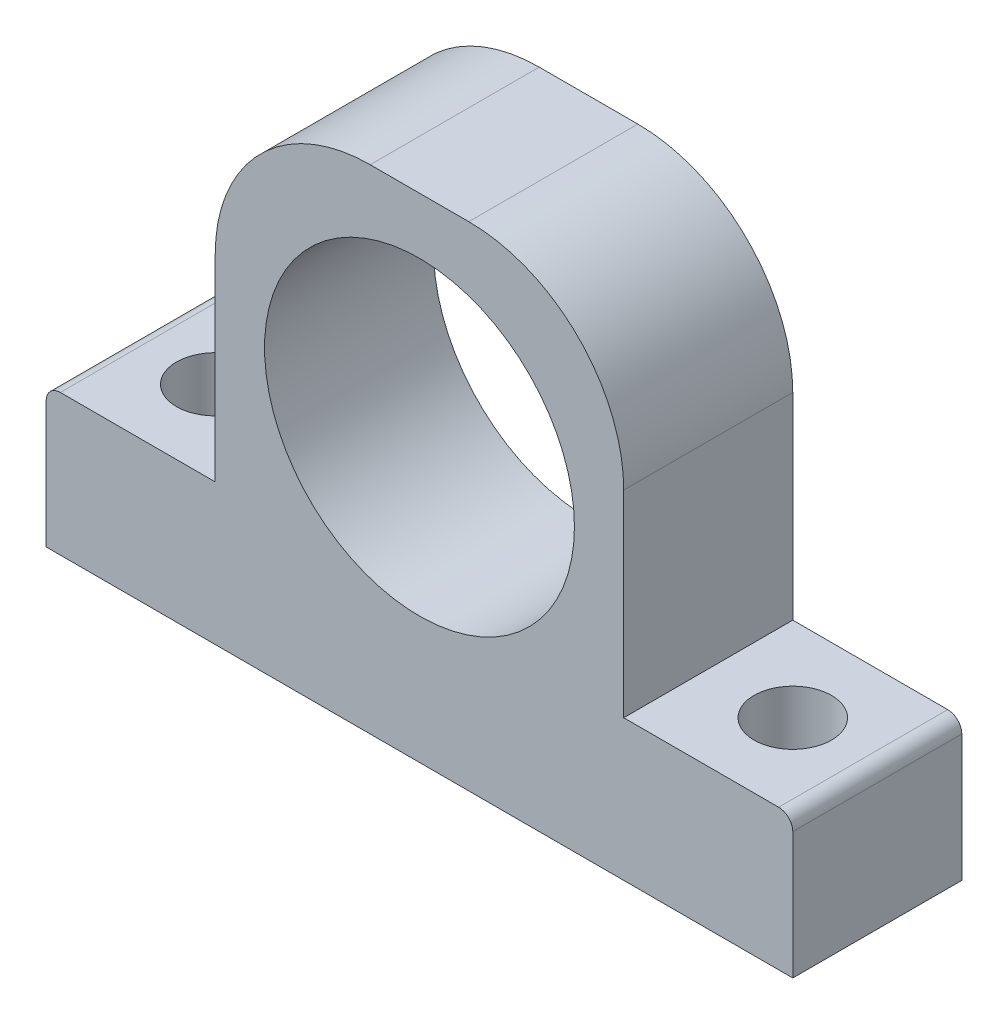
from build123d import *

# Parameters (mm, degrees)
SKETCH_1_R          = 11
EXTRUDE_1_DEPTH     = 12
SKETCH_2_R          = 2.75
CUT_EXTRUDE_1_DEPTH = 39.356876828


with BuildPart() as part:
    # 草图1 → 凸台-拉伸1 (new body)
    with BuildSketch(Plane.XY):
        with BuildLine():
            Line((14.5, 10), (25.5, 10))
            ThreePointArc((25.5, 10), (26.207106781, 9.707106781), (26.5, 9))
            Line((26.5, 9), (26.5, 0))
            Line((26.5, 0), (-26.5, 0))
            Line((-26.5, 0), (-26.5, 9))
            ThreePointArc((-26.5, 9), (-26.207106781, 9.707106781), (-25.5, 10))
            Line((-25.5, 10), (-14.5, 10))
            Line((-14.5, 10), (-14.5, 24))
            ThreePointArc((-14.5, 24), (-11.278174593, 31.778174593), (-3.5, 35))
            Line((-3.5, 35), (3.5, 35))
            ThreePointArc((3.5, 35), (11.278174593, 31.778174593), (14.5, 24))
            Line((14.5, 24), (14.5, 10))
        make_face()
        with Locations((0, 20)):
            Circle(SKETCH_1_R, mode=Mode.SUBTRACT)
    extrude(amount=EXTRUDE_1_DEPTH)

    # 草图2 → 切除-拉伸1 (cut, through all)
    with BuildSketch(Plane(origin=(0, 10, 0), x_dir=(1, 0, 0), z_dir=(0, 1, 0))):
        with Locations(Location((-20.5, -6, 0), (0, 0, 180))):
            Circle(SKETCH_2_R)
        with Locations((20.5, -6)):
            Circle(SKETCH_2_R)
    extrude(amount=-CUT_EXTRUDE_1_DEPTH, mode=Mode.SUBTRACT)


solid = part.part
